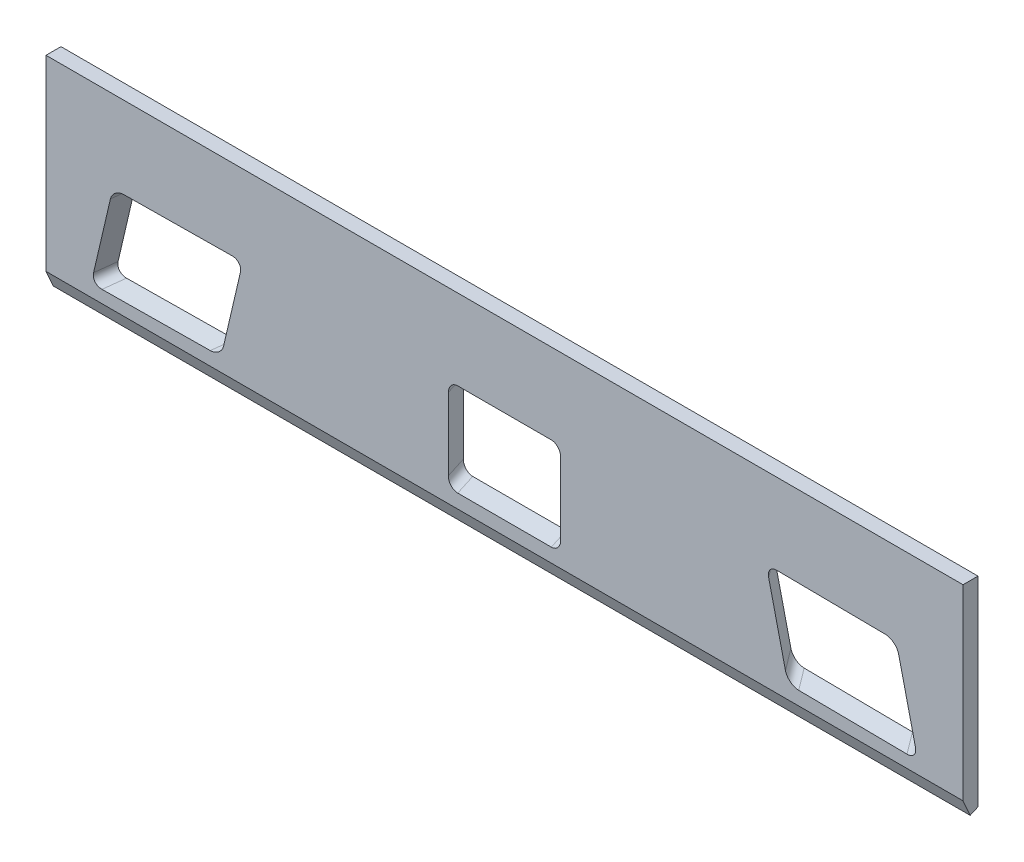
from build123d import *

# Parameters (mm, degrees)
CROQUIS1_W              = 98
CROQUIS1_H              = 20
SALIENTE_EXTRUIR1_DEPTH = 1.6
SALIENTE_EXTRUIR2_DEPTH = 98
CORTAR_EXTRUIR1_START   = -8
CORTAR_EXTRUIR1_DEPTH   = 20
CORTAR_EXTRUIR2_REACH   = 91.04


with BuildPart() as part:
    # Croquis1 → Saliente-Extruir1 (new body)
    with BuildSketch(Plane.XY):
        Rectangle(CROQUIS1_W, CROQUIS1_H)
    extrude(amount=SALIENTE_EXTRUIR1_DEPTH)

    # Croquis2 → Saliente-Extruir2 (add)
    with BuildSketch(Plane(origin=(49, 0, 0), x_dir=(0, 0, -1), z_dir=(1, 0, 0))):
        Polygon((0, -11.359205127), (-0.837384271, -11.728681668), (-1.6, -10), (0, -10), align=None)
    extrude(amount=-SALIENTE_EXTRUIR2_DEPTH)

    # Croquis3 → Cortar-Extruir1 (cut)
    with BuildSketch(Plane(origin=(0, -10.293644781, -14.534478238), x_dir=(-1, 0, 0), z_dir=(0, 0.42110532053516664, -0.9070117469013147)).offset(CORTAR_EXTRUIR1_START)):
        with BuildLine():
            Line((6, 9.403690819), (6, 16.403690819))
            ThreePointArc((6, 16.403690819), (5.707106781, 17.1107976), (5, 17.403690819))
            Line((5, 17.403690819), (-5, 17.403690819))
            ThreePointArc((-5, 17.403690819), (-5.707106781, 17.1107976), (-6, 16.403690819))
            Line((-6, 16.403690819), (-6, 9.403690819))
            ThreePointArc((-6, 9.403690819), (-5.707106781, 8.696584037), (-5, 8.403690819))
            Line((-5, 8.403690819), (5, 8.403690819))
            ThreePointArc((5, 8.403690819), (5.707106781, 8.696584037), (6, 9.403690819))
        make_face()
    extrude(amount=-CORTAR_EXTRUIR1_DEPTH, mode=Mode.SUBTRACT)

    # Cortar-Extruir2: from a plane face, 91.04 long prism both ways, kept between that surface and its translate by the depth
    cortar_extruir2_start = Plane(origin=(0, 0, 1.6), z_dir=(0, 0, -1)) * Box(366.16, 366.16, 183.08, align=(Align.CENTER, Align.CENTER, Align.MIN), mode=Mode.PRIVATE)
    cortar_extruir2_end = Plane(origin=(-9.998158796, 7.340799912, -14.089151581), z_dir=(0, 0, -1)) * Box(366.16, 366.16, 183.08, align=(Align.CENTER, Align.CENTER, Align.MIN), mode=Mode.PRIVATE)
    # Croquis4 → Cortar-Extruir2 (cut, from a surface)
    with BuildSketch(Plane(origin=(15.242771226, -12.659892112, -9.623968273), x_dir=(-0.8660785482382583, -0.21185862229734287, 0.4527956188389888), z_dir=(-0.49990793980643183, 0.36703999560816625, -0.7844575790585788)), mode=Mode.PRIVATE) as cortar_extruir2_sk1:
        with BuildLine():
            Line((-8.828097078, 9.489452405), (-8.905642597, 16.48902287))
            ThreePointArc((-8.905642597, 16.48902287), (-9.206351123, 17.19284161), (-9.916659166, 17.477883576))
            Line((-9.916659166, 17.477883576), (-19.916045544, 17.367104263))
            ThreePointArc((-19.916045544, 17.367104263), (-20.619864285, 17.066395736), (-20.904906251, 16.356087694))
            Line((-20.904906251, 16.356087694), (-20.827360732, 9.356517229))
            ThreePointArc((-20.827360732, 9.356517229), (-20.526652205, 8.652698488), (-19.816344162, 8.367656522))
            Line((-19.816344162, 8.367656522), (-9.816957784, 8.478435835))
            ThreePointArc((-9.816957784, 8.478435835), (-9.113139043, 8.779144362), (-8.828097078, 9.489452405))
        make_face()
    cortar_extruir2_tool1 = extrude(cortar_extruir2_sk1.sketch, amount=CORTAR_EXTRUIR2_REACH, both=True, mode=Mode.PRIVATE)
    cortar_extruir2 = ((cortar_extruir2_tool1 & cortar_extruir2_start) - cortar_extruir2_end).solids().sort_by_distance((35.560858, -3.26981, 0.8))[0]
    add(cortar_extruir2, mode=Mode.SUBTRACT)

    # Simetría1: Cortar-Extruir2 across plane
    add(cortar_extruir2.mirror(Plane(origin=(0, 0, 0), x_dir=(0, 0, 1), z_dir=(1, 0, 0))), mode=Mode.SUBTRACT)


solid = part.part
